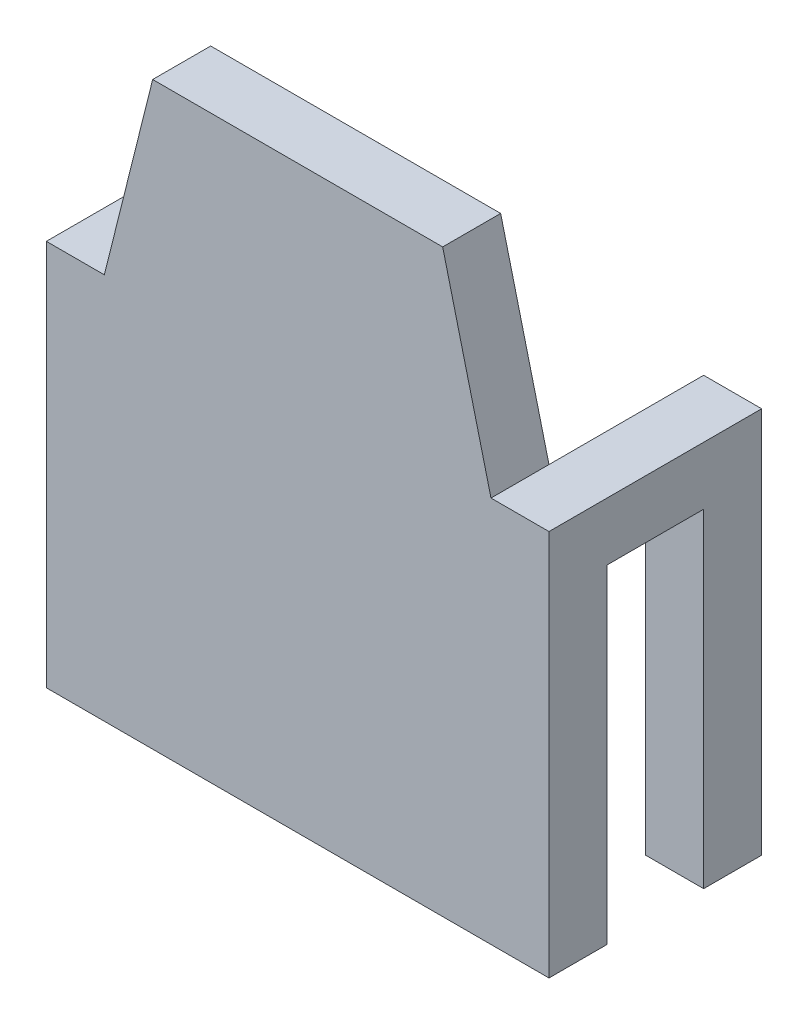
from build123d import *

# Parameters (mm, degrees)
EXTRUDE_1_DEPTH     = 3
SKETCH_4_W          = 3
SKETCH_4_H          = 3
EXTRUDE_2_DEPTH     = 8
SKETCH_5_W          = 3
SKETCH_5_H          = 3
EXTRUDE_3_DEPTH     = 17
SKETCH_6_R          = 5
CUT_EXTRUDE_1_DEPTH = 2


with BuildPart() as part:
    # 草图1 → 凸台-拉伸1 (new body)
    with BuildSketch(Plane.XY):
        Polygon((2.5, 0), (0, -10), (-3, -10), (-3, -30), (0, -30), (20, -30), (23, -30), (23, -10), (20, -10), (17.5, 0), align=None)
    extrude(amount=EXTRUDE_1_DEPTH)

    # 草图4 → 凸台-拉伸2 (add)
    with BuildSketch(Plane(origin=(0, 0, 0), x_dir=(-1, 0, 0), z_dir=(0, 0, -1))):
        with Locations((-21.5, -11.5)):
            Rectangle(SKETCH_4_W, SKETCH_4_H)
        with Locations((1.5, -11.5)):
            Rectangle(SKETCH_4_W, SKETCH_4_H)
    extrude(amount=EXTRUDE_2_DEPTH)

    # 草图5 → 凸台-拉伸3 (add)
    with BuildSketch(Plane.XZ.offset(13)):
        with Locations((-1.5, -6.5)):
            Rectangle(SKETCH_5_W, SKETCH_5_H)
        with Locations((21.5, -6.5)):
            Rectangle(SKETCH_5_W, SKETCH_5_H)
    extrude(amount=EXTRUDE_3_DEPTH)

    # 草图6 → 切除-拉伸1 (cut)
    with BuildSketch(Plane(origin=(0, 0, 0), x_dir=(-1, 0, 0), z_dir=(0, 0, -1))):
        with Locations((-10, -20)):
            Circle(SKETCH_6_R)
    extrude(amount=-CUT_EXTRUDE_1_DEPTH, mode=Mode.SUBTRACT)


solid = part.part
